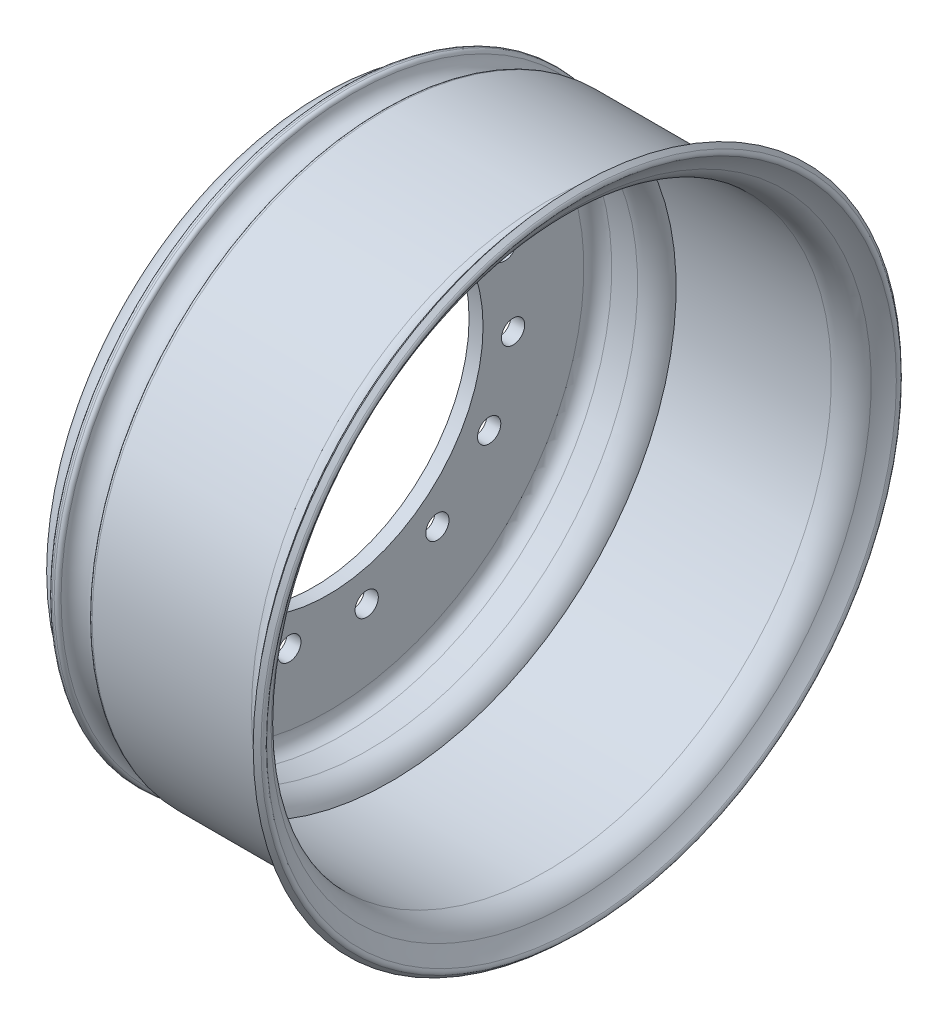
from build123d import *

# Parameters (mm, degrees)
SKETCH2_R          = 7.5
CUT_EXTRUDE1_DEPTH = 343.893798837
CIRPATTERN1_COUNT  = 15
FILLET1_R          = 2.5
FILLET2_R          = 2.5
FILLET3_R          = 2.5


with BuildPart() as part:
    # Sketch1 → Revolve1 (revolve)
    with BuildSketch(Plane.XY, mode=Mode.PRIVATE) as revolve1_sk:
        with BuildLine():
            Line((6, 190), (0, 190))
            Line((0, 190), (0, 184))
            Line((0, 184), (1.167603026, 184))
            ThreePointArc((1.167603026, 184), (1.381500916, 183.496194611), (1.61250543, 183))
            Line((1.61250543, 183), (-0.654113464, 183))
            ThreePointArc((-0.654113464, 183), (-13.382035525, 177.727922061), (-18.654113464, 165))
            Line((-18.654113464, 165), (-18.654113464, 100))
            Line((-18.654113464, 100), (-9.654113464, 100))
            Line((-9.654113464, 100), (-9.654113464, 165))
            ThreePointArc((-9.654113464, 165), (-7.018074494, 171.363961031), (-0.654113464, 174))
            Line((-0.654113464, 174), (16, 174))
            ThreePointArc((16, 174), (24.94427191, 176.733500839), (30.832396974, 184))
            Line((30.832396974, 184), (131, 184))
            ThreePointArc((131, 184), (140.363111384, 186.544369482), (147.150740079, 193.477605923))
            ThreePointArc((147.150740079, 193.477605923), (150.936592061, 199.396696214), (155.399246684, 204.823759769))
            Line((155.399246684, 204.823759769), (151, 208.903787786))
            ThreePointArc((151, 208.903787786), (146.083516094, 202.924819463), (141.912662216, 196.403787786))
            ThreePointArc((141.912662216, 196.403787786), (137.326426611, 191.719168569), (131, 190))
            Line((131, 190), (26, 190))
            ThreePointArc((26, 190), (16, 180), (6, 190))
        make_face()
    revolve(revolve1_sk.sketch.rotate(Axis((0, 0, 0), (1, 0, 0)), 90), axis=Axis((0, 0, 0), (1, 0, 0)))

    # Sketch2 → Cut-Extrude1 (cut, through all)
    with BuildSketch(Plane.ZY.offset(18.654113464)):
        with Locations((0, 120)):
            Circle(SKETCH2_R)
    cut_extrude1 = extrude(amount=-CUT_EXTRUDE1_DEPTH, mode=Mode.SUBTRACT)

    # CirPattern1: Cut-Extrude1 ×15 about axis
    cirpattern1_axis = Axis((0, 0, 0), (1, 0, 0))
    for i in range(1, CIRPATTERN1_COUNT):
        add(cut_extrude1.rotate(cirpattern1_axis, i * 360 / CIRPATTERN1_COUNT), mode=Mode.SUBTRACT)

    # Fillet1
    fillet1_edges = [part.edges().sort_by_distance(p)[0] for p in [
        (155.399246684, 0, -204.823759769),
    ]]
    fillet(fillet1_edges, radius=FILLET1_R)

    # Fillet2
    fillet2_edges = [part.edges().sort_by_distance(p)[0] for p in [
        (6, 0, -190),
        (26, 0, -190),
    ]]
    fillet(fillet2_edges, radius=FILLET2_R)

    # Fillet3
    fillet3_edges = [part.edges().sort_by_distance(p)[0] for p in [
        (0, 0, -190),
    ]]
    fillet(fillet3_edges, radius=FILLET3_R)


solid = part.part
